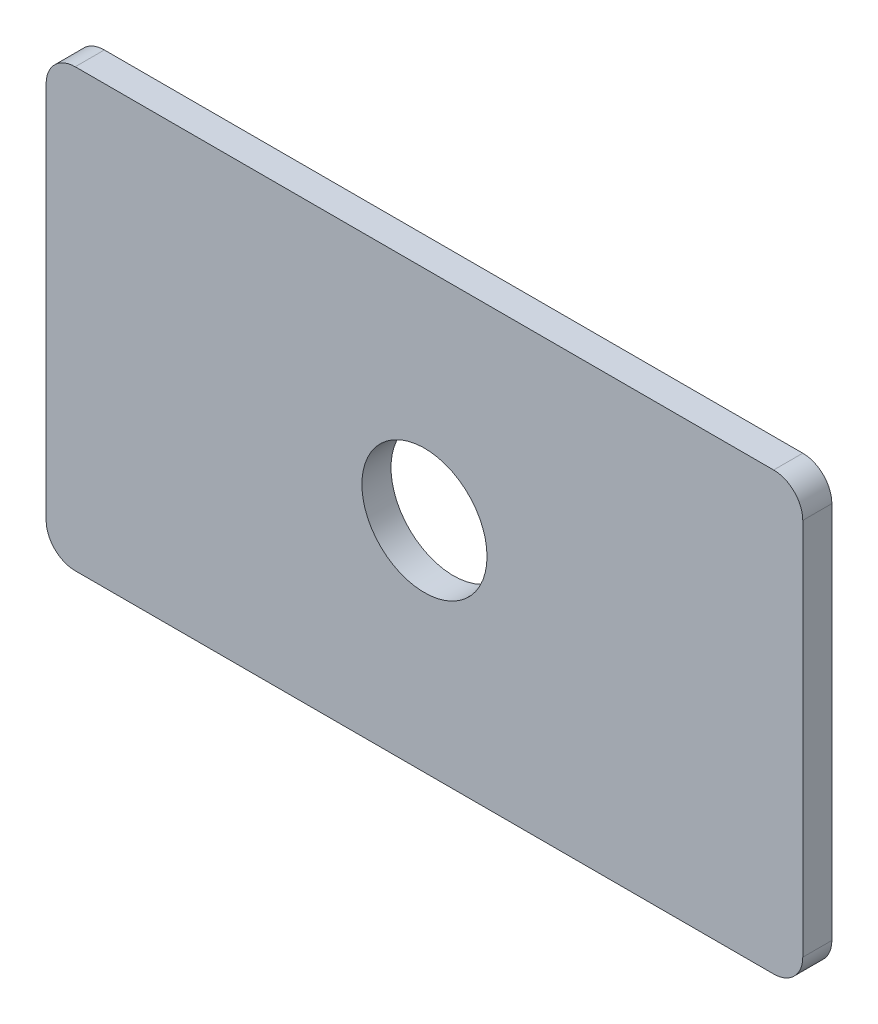
from build123d import *

# Parameters (mm, degrees)
SKETCH_1_W      = 260
SKETCH_1_H      = 150
SKETCH_1_R      = 21.5
EXTRUDE_1_DEPTH = 5
FILLET_1_R      = 10


with BuildPart() as part:
    # Эскиз1 → Бобышка-Вытянуть1 (new, symmetric)
    with BuildSketch(Plane.XY):
        Rectangle(SKETCH_1_W, SKETCH_1_H)
        Circle(SKETCH_1_R, mode=Mode.SUBTRACT)
    extrude(amount=EXTRUDE_1_DEPTH, both=True)

    # Скругление1
    fillet_1_edges = [part.edges().sort_by_distance(p)[0] for p in [
        (130, -75, 0),
        (-130, -75, 0),
        (-130, 75, 0),
        (130, 75, 0),
    ]]
    fillet(fillet_1_edges, radius=FILLET_1_R)


solid = part.part
